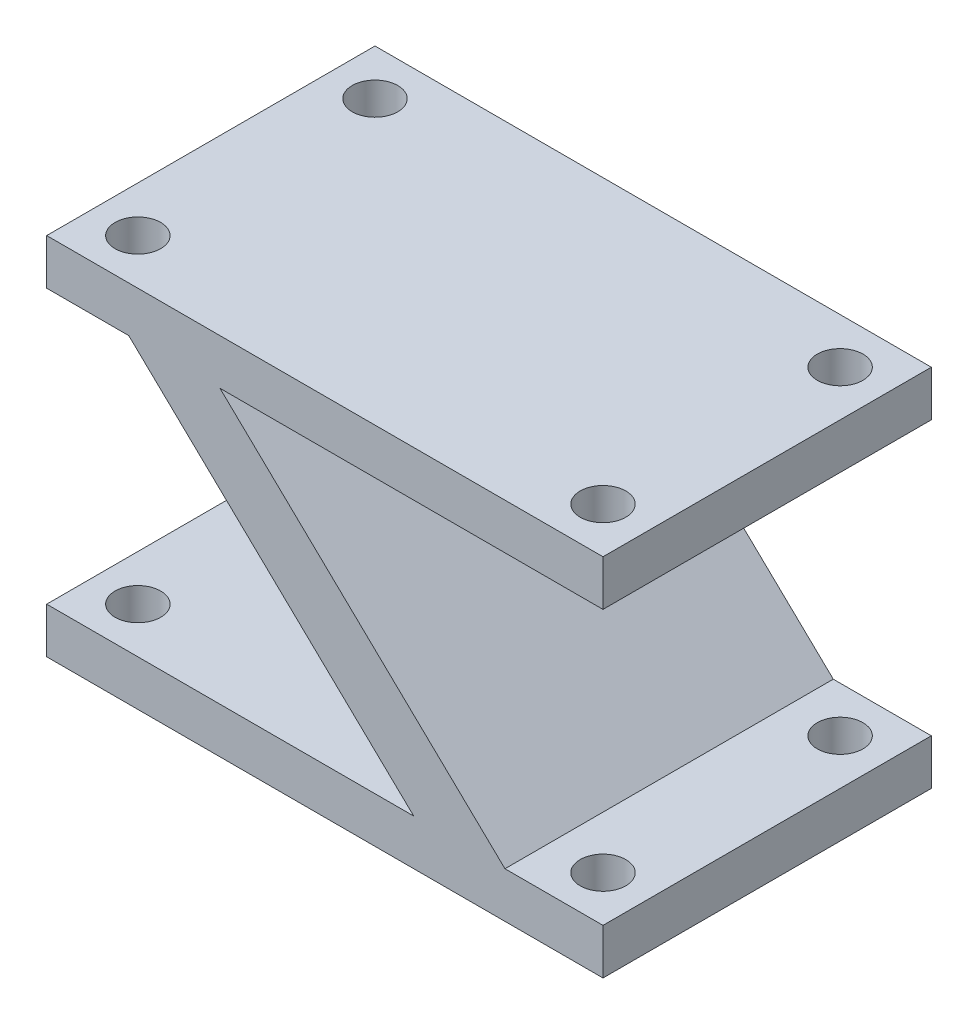
from build123d import *

# Parameters (mm, degrees)
SKETCH1_W           = 61
SKETCH1_H           = 36
SKETCH1_R           = 2.5
BOSS_EXTRUDE1_DEPTH = 5
BOSS_EXTRUDE3_DEPTH = 36
SKETCH5_W           = 61
SKETCH5_H           = 36
SKETCH5_R           = 2.5
BOSS_EXTRUDE4_DEPTH = 5


with BuildPart() as part:
    # Sketch1 → Boss-Extrude1 (new body)
    with BuildSketch(Plane(origin=(0, 0, 0), x_dir=(1, 0, 0), z_dir=(0, 1, 0))):
        Rectangle(SKETCH1_W, SKETCH1_H)
        with Locations(Location((-25.5, 13, 0), (0, 0, 270))):
            Circle(SKETCH1_R, mode=Mode.SUBTRACT)
        with Locations(Location((25.5, 13, 0), (0, 0, 270))):
            Circle(SKETCH1_R, mode=Mode.SUBTRACT)
        with Locations(Location((25.5, -13, 0), (0, 0, 270))):
            Circle(SKETCH1_R, mode=Mode.SUBTRACT)
        with Locations(Location((-25.5, -13, 0), (0, 0, 270))):
            Circle(SKETCH1_R, mode=Mode.SUBTRACT)
    extrude(amount=BOSS_EXTRUDE1_DEPTH)

    # Sketch4 → Boss-Extrude3 (add)
    with BuildSketch(Plane.XY.offset(18)):
        Polygon((19.75, 5), (-11.5, 35), (-21.5, 35), (9.75, 5), align=None)
    extrude(amount=-BOSS_EXTRUDE3_DEPTH)

    # Sketch5 → Boss-Extrude4 (add)
    with BuildSketch(Plane(origin=(0, 35, 0), x_dir=(1, 0, 0), z_dir=(0, 1, 0))):
        Rectangle(SKETCH5_W, SKETCH5_H)
        with Locations(Location((-25.5, -13, 0), (0, 0, 270))):
            Circle(SKETCH5_R, mode=Mode.SUBTRACT)
        with Locations(Location((-25.5, 13, 0), (0, 0, 270))):
            Circle(SKETCH5_R, mode=Mode.SUBTRACT)
        with Locations(Location((25.5, 13, 0), (0, 0, 270))):
            Circle(SKETCH5_R, mode=Mode.SUBTRACT)
        with Locations(Location((25.5, -13, 0), (0, 0, 270))):
            Circle(SKETCH5_R, mode=Mode.SUBTRACT)
    extrude(amount=BOSS_EXTRUDE4_DEPTH)


solid = part.part
